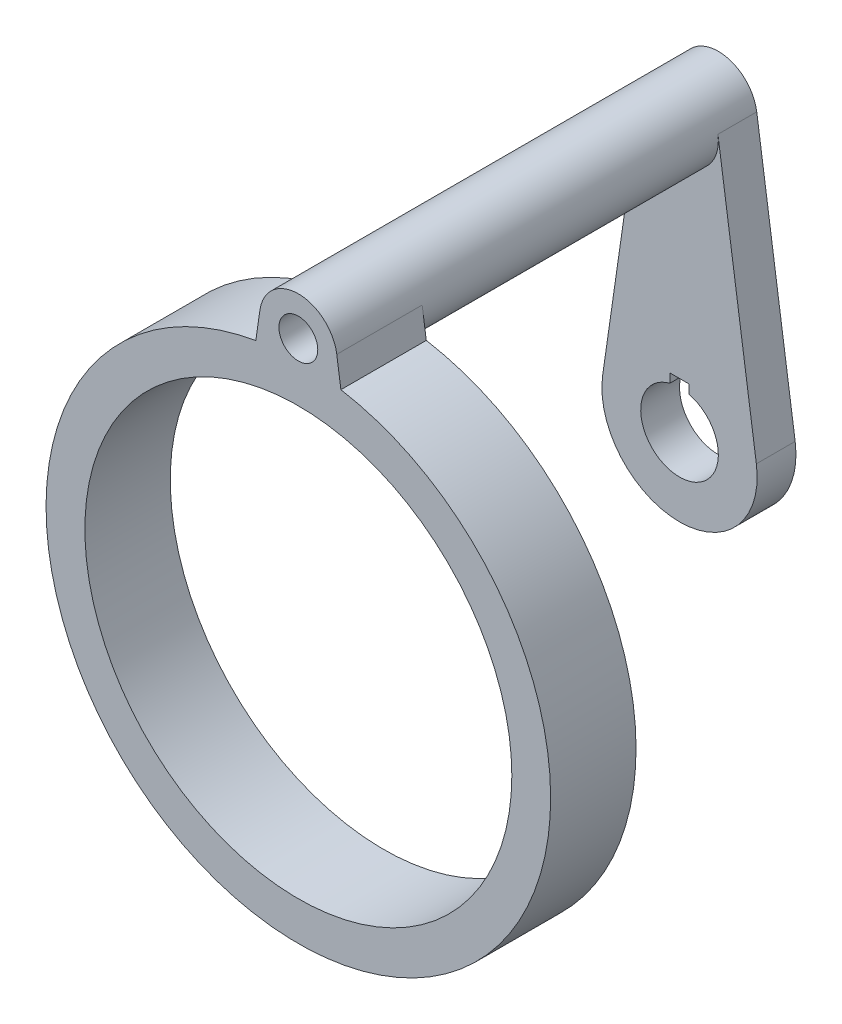
from build123d import *

# Parameters (mm, degrees)
SKETCH2_R           = 5
BOSS_EXTRUDE1_DEPTH = 10
SKETCH3_R           = 10
SKETCH3_R_2         = 5
BOSS_EXTRUDE2_DEPTH = 76.2
BOSS_EXTRUDE3_START = 86.2
SKETCH2_2_R         = 5
BOSS_EXTRUDE3_DEPTH = 22
SKETCH5_R           = 65
BOSS_EXTRUDE4_DEPTH = 22
SKETCH6_R           = 55
CUT_EXTRUDE1_DEPTH  = 22


with BuildPart() as part:
    # Sketch2 → Boss-Extrude1 (new body)
    with BuildSketch(Plane.XY):
        with BuildLine():
            Line((-19.794866372, 2.857142857), (-9.897433186, 71.428571429))
            ThreePointArc((-9.897433186, 71.428571429), (0, 80), (9.897433186, 71.428571429))
            Line((9.897433186, 71.428571429), (19.794866372, 2.857142857))
            ThreePointArc((19.794866372, 2.857142857), (0, -20), (-19.794866372, 2.857142857))
        make_face()
        with Locations((0, 70)):
            Circle(SKETCH2_R, mode=Mode.SUBTRACT)
        with BuildLine():
            Line((-2.5, 9.682458366), (-2.5, 12))
            Line((-2.5, 12), (2.5, 12))
            Line((2.5, 12), (2.5, 9.682458366))
            ThreePointArc((2.5, 9.682458366), (0, -10), (-2.5, 9.682458366))
        make_face(mode=Mode.SUBTRACT)
    extrude(amount=BOSS_EXTRUDE1_DEPTH)

    # Sketch3 → Boss-Extrude2 (add)
    with BuildSketch(Plane.XY.offset(10)):
        with Locations(Location((0, 70, 0), (0, 0, 171.786789298))):
            Circle(SKETCH3_R)
        with Locations((0, 70)):
            Circle(SKETCH3_R_2, mode=Mode.SUBTRACT)
    extrude(amount=BOSS_EXTRUDE2_DEPTH)

    # Sketch2<2> → Boss-Extrude3 (add)
    with BuildSketch(Plane.XY.offset(BOSS_EXTRUDE3_START)):
        with BuildLine():
            Line((-19.794866372, 2.857142857), (-9.897433186, 71.428571429))
            ThreePointArc((-9.897433186, 71.428571429), (0, 80), (9.897433186, 71.428571429))
            Line((9.897433186, 71.428571429), (19.794866372, 2.857142857))
            ThreePointArc((19.794866372, 2.857142857), (0, -20), (-19.794866372, 2.857142857))
        make_face()
        with Locations((0, 70)):
            Circle(SKETCH2_2_R, mode=Mode.SUBTRACT)
        with BuildLine():
            Line((-2.5, 9.682458366), (-2.5, 12))
            Line((-2.5, 12), (2.5, 12))
            Line((2.5, 12), (2.5, 9.682458366))
            ThreePointArc((2.5, 9.682458366), (0, -10), (-2.5, 9.682458366))
        make_face(mode=Mode.SUBTRACT)
    extrude(amount=BOSS_EXTRUDE3_DEPTH)

    # Sketch5 → Boss-Extrude4 (add)
    with BuildSketch(Plane.XY.offset(108.2)):
        Circle(SKETCH5_R)
    extrude(amount=-BOSS_EXTRUDE4_DEPTH)

    # Sketch6 → Cut-Extrude1 (cut)
    with BuildSketch(Plane.XY.offset(108.2)):
        Circle(SKETCH6_R)
    extrude(amount=-CUT_EXTRUDE1_DEPTH, mode=Mode.SUBTRACT)


solid = part.part
